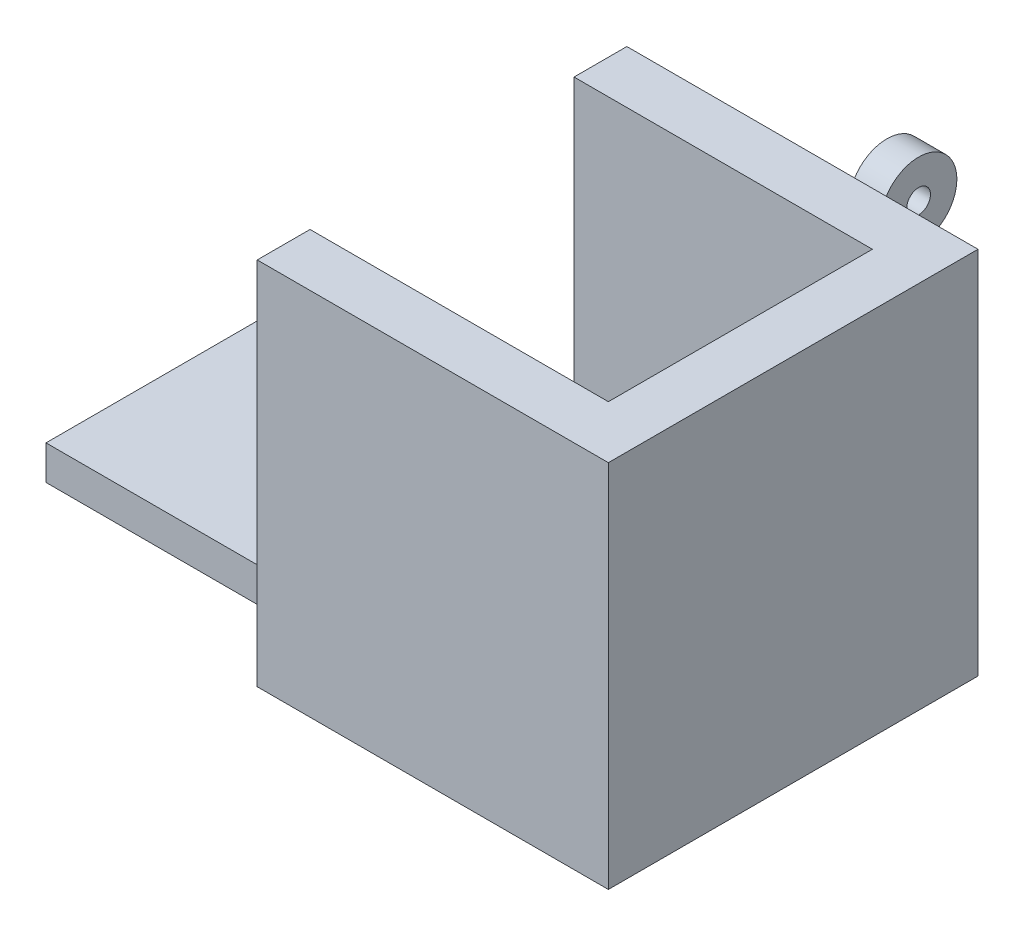
from build123d import *

# Parameters (mm, degrees)
SKETCH_1_W          = 133
SKETCH_1_H          = 140
EXTRUDE_1_DEPTH     = 140
SKETCH_2_W          = 113
SKETCH_2_H          = 100
CUT_EXTRUDE_1_DEPTH = 110
SKETCH_3_W          = 100
SKETCH_3_H          = 13
EXTRUDE_2_DEPTH     = 100
SKETCH_4_R          = 3
CUT_EXTRUDE_3_DEPTH = 217.846143613
SKETCH_5_W          = 12
SKETCH_5_H          = 12
EXTRUDE_3_DEPTH     = 10
SKETCH_6_R          = 14.490887282
SKETCH_6_R_2        = 4.490887282
EXTRUDE_2_2_DEPTH   = 12
SKETCH_7_R          = 4.490887282
CUT_EXTRUDE_4_DEPTH = 265.708919896


with BuildPart() as part:
    # 草圖1 → 填料-伸長1 (new body)
    with BuildSketch(Plane(origin=(0, 0, 0), x_dir=(1, 0, 0), z_dir=(0, 1, 0))):
        Rectangle(SKETCH_1_W, SKETCH_1_H)
    extrude(amount=EXTRUDE_1_DEPTH)

    # 草圖2 → 除料-伸長1 (cut)
    with BuildSketch(Plane(origin=(0, 140, 0), x_dir=(1, 0, 0), z_dir=(0, 1, 0))):
        with Locations((-10, 0)):
            Rectangle(SKETCH_2_W, SKETCH_2_H)
    extrude(amount=-CUT_EXTRUDE_1_DEPTH, mode=Mode.SUBTRACT)

    # 草圖3 → Extrude 2 (add)
    with BuildSketch(Plane.ZY.offset(66.5)):
        with Locations((0, 13.5)):
            Rectangle(SKETCH_3_W, SKETCH_3_H)
    extrude(amount=EXTRUDE_2_DEPTH)

    # 草圖4 → 除料-伸長3 (cut, through all)
    with BuildSketch(Plane(origin=(0, 20, 0), x_dir=(1, 0, 0), z_dir=(0, 1, 0))):
        with Locations(Location((-86.5, 0, 0), (0, 0, 270))):
            Circle(SKETCH_4_R)
    extrude(amount=-CUT_EXTRUDE_3_DEPTH, mode=Mode.SUBTRACT)

    # 草圖5 → 填料-伸長3 (add)
    with BuildSketch(Plane(origin=(0, 0, -70), x_dir=(-1, 0, 0), z_dir=(0, 0, -1))):
        with Locations((-25.5, 126)):
            Rectangle(SKETCH_5_W, SKETCH_5_H)
    extrude(amount=EXTRUDE_3_DEPTH)

    # 草圖6 → Extrude 2 2 (add)
    with BuildSketch(Plane(origin=(31.5, 0, 0), x_dir=(0, 0, -1), z_dir=(1, 0, 0))):
        with Locations((82.5, 132)):
            Circle(SKETCH_6_R)
        with Locations((82.5, 132)):
            Circle(SKETCH_6_R_2, mode=Mode.SUBTRACT)
    extrude(amount=-EXTRUDE_2_2_DEPTH)

    # 草圖7 → 除料-伸長4 (cut, through all)
    with BuildSketch(Plane(origin=(31.5, 0, 0), x_dir=(0, 0, -1), z_dir=(1, 0, 0))):
        with Locations((82.5, 132)):
            Circle(SKETCH_7_R)
    extrude(amount=-CUT_EXTRUDE_4_DEPTH, mode=Mode.SUBTRACT)


solid = part.part
